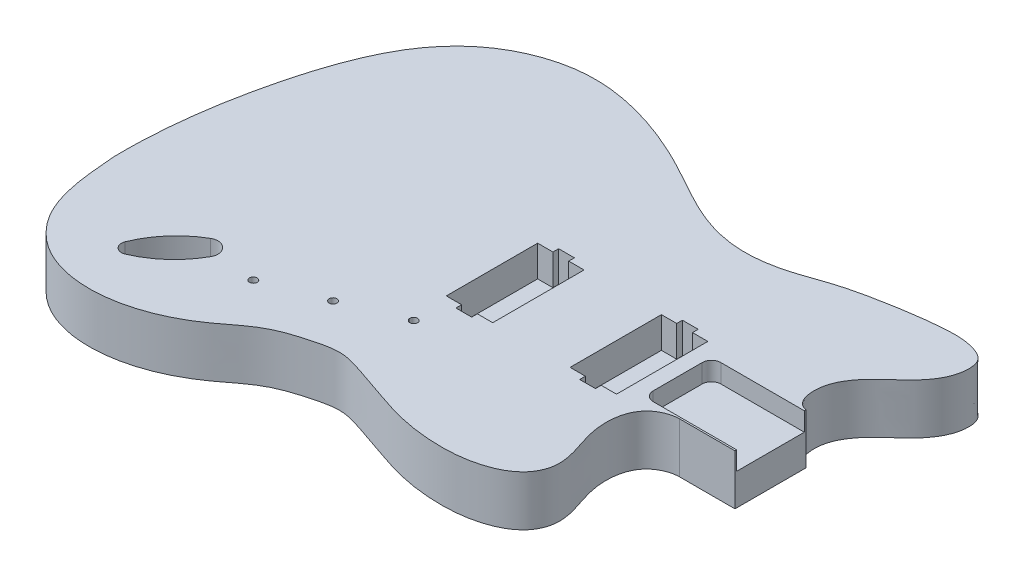
from build123d import *

# Parameters (mm, degrees)
BOSS_EXTRUDE1_DEPTH = 41.275
SKETCH6_W           = 76.2
SKETCH6_H           = 55.5625
CUT_EXTRUDE4_DEPTH  = 15.24
FILLET5_R           = 7.62
CUT_EXTRUDE6_DEPTH  = 25.4
CUT_EXTRUDE7_DEPTH  = 25.4
SKETCH10_R          = 3.175
CUT_EXTRUDE8_DEPTH  = 76.2


with BuildPart() as part:
    # Sketch2 → Boss-Extrude1 (new body)
    with BuildSketch(Plane(origin=(0, 0, 0), x_dir=(1, 0, 0), z_dir=(0, 1, 0))):
        with BuildLine():
            Line((509.085467797, 191.553525985), (554.494928645, 191.553525985))
            Line((554.494928645, 191.553525985), (554.494928645, 249.904235002))
            add(Edge.make_bspline(
                [(90.500026047, 145.719708809), (89.802029853, 183.371850788), (96.511492218, 236.355913248), (115.870337657, 306.516365252), (135.570664397, 349.324631144), (173.033629511, 385.240749449), (220.6034091, 402.51741798), (279.722097624, 393.299008973), (325.55791088, 372.569597213), (360.608147582, 351.775493279), (386.684398592, 340.659830669), (415.778600245, 334.711262077), (447.167517605, 339.507629156), (478.015579204, 351.745933286), (511.646565599, 358.953142265), (545.972395081, 364.25009995), (573.451291126, 365.275478162), (591.2364529, 357.329515448), (592.850754143, 344.076097244), (589.242521553, 328.849375548), (577.700047901, 314.218770689), (562.451551847, 301.799240171), (550.087476355, 288.203216443), (541.882676348, 269.989405146), (545.59058529, 251.213847843), (554.494928645, 249.904235002)],
                knots=[0, 0, 0, 0, 0.13775138, 0.193404483, 0.266847255, 0.306068759, 0.381118346, 0.441463846, 0.520688543, 0.563923363, 0.590495867, 0.624101664, 0.671189484, 0.704010795, 0.74545192, 0.796656066, 0.8306461, 0.846610089, 0.860786322, 0.874697064, 0.903946738, 0.926062898, 0.947253339, 0.969960817, 1, 1, 1, 1], degree=3))
            add(Edge.make_bspline(
                [(90.500026047, 145.719708809), (92.402722254, 123.486911287), (94.5261105, 85.421488414), (130.636221075, 48.442031825), (169.854108533, 39.277092377), (210.880220395, 45.729353831), (245.227609801, 62.992916981), (272.492474934, 87.208534485), (299.83592433, 95.592945812), (323.874448139, 101.164266259), (342.334928996, 94.989191015), (364.305117352, 87.801201524), (391.505896268, 77.449574411), (425.194489111, 72.740033743), (458.254104424, 75.040646311), (483.562544172, 86.432089871), (492.245066229, 105.918025172), (490.235194897, 124.644247505), (479.574562349, 148.058158908), (481.118471371, 182.615397185), (501.832534703, 191.509682343), (509.085467797, 191.553525985)],
                knots=[0, 0, 0, 0, 0.116243016, 0.176387183, 0.246646035, 0.309540553, 0.382135802, 0.436863479, 0.490014091, 0.524291964, 0.558001643, 0.585151079, 0.641136195, 0.703675246, 0.753688136, 0.808744692, 0.830256544, 0.856511448, 0.899935694, 0.963113053, 1, 1, 1, 1], degree=3))
        make_face()
    extrude(amount=BOSS_EXTRUDE1_DEPTH)

    # Sketch6 → Cut-Extrude4 (cut)
    with BuildSketch(Plane(origin=(0, 41.275, 0), x_dir=(1, 0, 0), z_dir=(0, 1, 0))):
        with Locations((516.394928645, 220.725985002)):
            Rectangle(SKETCH6_W, SKETCH6_H)
    extrude(amount=-CUT_EXTRUDE4_DEPTH, mode=Mode.SUBTRACT)

    # Fillet5
    fillet5_edges = [part.edges().sort_by_distance(p)[0] for p in [
        (478.294928645, 33.655, -192.944735002),
        (478.294928645, 33.655, -248.507235002),
    ]]
    fillet(fillet5_edges, radius=FILLET5_R)

    # Sketch7 → Cut-Extrude6 (cut)
    with BuildSketch(Plane(origin=(0, 41.275, 0), x_dir=(1, 0, 0), z_dir=(0, 1, 0))):
        Polygon((338.430385795, 183.203835002), (338.430385795, 178.530235002), (351.384385795, 178.530235002), (351.384385795, 183.203835002), (363.994928645, 183.203835002), (363.994928645, 258.184635002), (351.384385795, 258.184635002), (351.384385795, 262.858235002), (338.430385795, 262.858235002), (338.430385795, 258.184635002), (325.894928645, 258.184635002), (325.894928645, 183.203835002), align=None)
        Polygon((453.001918211, 258.184635002), (453.001918211, 262.858235002), (440.047918211, 262.858235002), (440.047918211, 258.184635002), (427.494928645, 258.184635002), (427.494928645, 183.203835002), (440.047918211, 183.203835002), (440.047918211, 178.530235002), (453.001918211, 178.530235002), (453.001918211, 183.203835002), (465.594928645, 183.203835002), (465.594928645, 258.184635002), align=None)
    extrude(amount=-CUT_EXTRUDE6_DEPTH, mode=Mode.SUBTRACT)

    # Sketch9 → Cut-Extrude7 (cut)
    with BuildSketch(Plane(origin=(0, 41.275, 0), x_dir=(1, 0, 0), z_dir=(0, 1, 0))):
        with BuildLine():
            ThreePointArc((201.343717425, 114.500240339), (199.677092238, 125.889986979), (188.259993692, 127.357579843))
            ThreePointArc((188.259993692, 127.357579843), (168.787199798, 111.383477208), (155.585468224, 89.93409632))
            ThreePointArc((155.585468224, 89.93409632), (157.109891345, 82.573288652), (164.496182778, 81.177561515))
            ThreePointArc((164.496182778, 81.177561515), (185.711894836, 94.751625715), (201.343717425, 114.500240339))
        make_face()
    extrude(amount=-CUT_EXTRUDE7_DEPTH, mode=Mode.SUBTRACT)

    # Sketch10 → Cut-Extrude8 (cut)
    with BuildSketch(Plane(origin=(0, 41.275, 0), x_dir=(1, 0, 0), z_dir=(0, 1, 0))):
        with Locations(Location((330.01909551, 152.325567708, 0), (0, 0, 270))):
            Circle(SKETCH10_R)
        with Locations(Location((282.967488546, 133.173902452, 0), (0, 0, 270))):
            Circle(SKETCH10_R)
        with Locations(Location((235.445506187, 115.221153561, 0), (0, 0, 270))):
            Circle(SKETCH10_R)
    extrude(amount=-CUT_EXTRUDE8_DEPTH, mode=Mode.SUBTRACT)


solid = part.part
